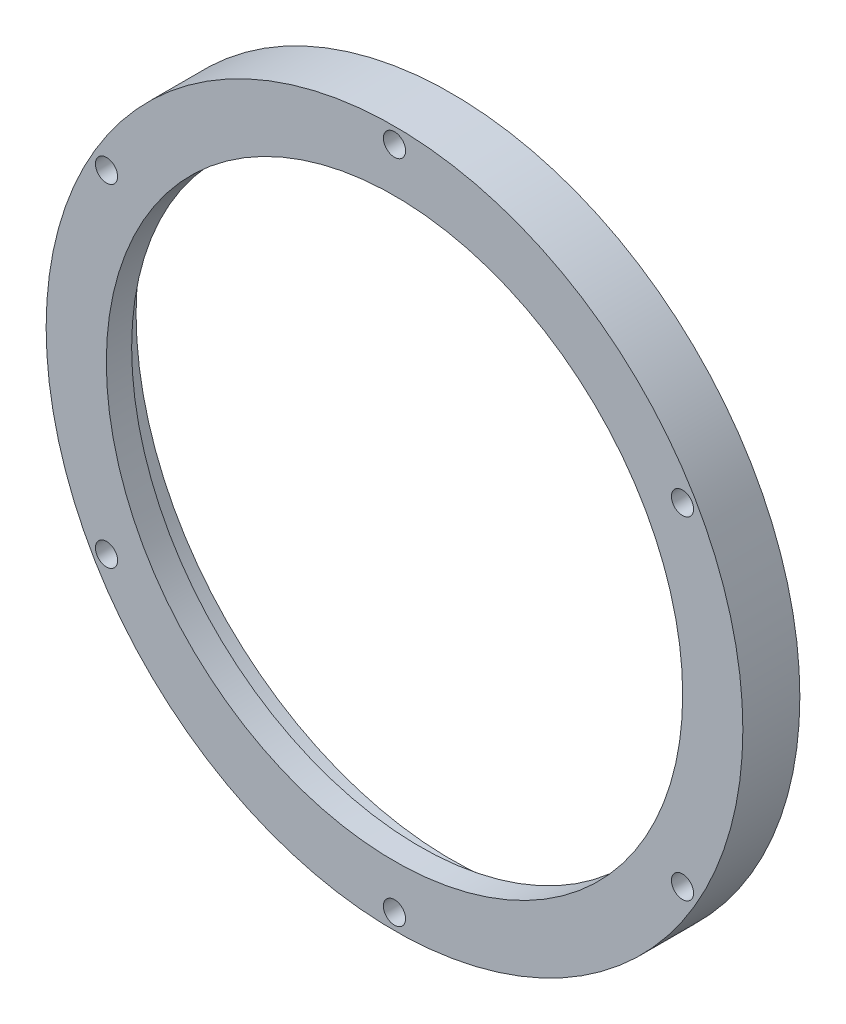
from build123d import *

# Parameters (mm, degrees)
SKETCH_1_R               = 55
SKETCH_1_R_2             = 45.5
EXTRUDE_1_DEPTH          = 9
SKETCH_2_R               = 1.75
CUT_EXTRUDE_1_DEPTH      = 9
PATTERN_CIRCULAR_1_COUNT = 6


with BuildPart() as part:
    # 草图1 → 凸台-拉伸1 (new body)
    with BuildSketch(Plane.XY):
        Circle(SKETCH_1_R)
        Circle(SKETCH_1_R_2, mode=Mode.SUBTRACT)
    extrude(amount=EXTRUDE_1_DEPTH)

    # 草图2 → 切除-拉伸1 (cut)
    with BuildSketch(Plane.XY.offset(9)):
        with Locations((0, 52.5)):
            Circle(SKETCH_2_R)
    cut_extrude_1 = extrude(amount=-CUT_EXTRUDE_1_DEPTH, mode=Mode.SUBTRACT)

    # 阵列(圆周)1: 切除-拉伸1 ×6 about axis
    pattern_circular_1_axis = Axis((0, 0, 0), (0, 0, 1))
    for i in range(1, PATTERN_CIRCULAR_1_COUNT):
        add(cut_extrude_1.rotate(pattern_circular_1_axis, i * 360 / PATTERN_CIRCULAR_1_COUNT), mode=Mode.SUBTRACT)

    # 草图3 → 切除-旋转1 (revolve, cut)
    with BuildSketch(Plane(origin=(0, 0, 0), x_dir=(1, 0, 0), z_dir=(0, 1, 0))):
        Polygon((-49.8, 0), (-49.8, -5), (-46.83072822, -5), (-45.5, -5), (-45.5, 0), align=None)
    revolve(axis=Axis((0, 0, 0), (0, 0, 1)), mode=Mode.SUBTRACT)


solid = part.part
